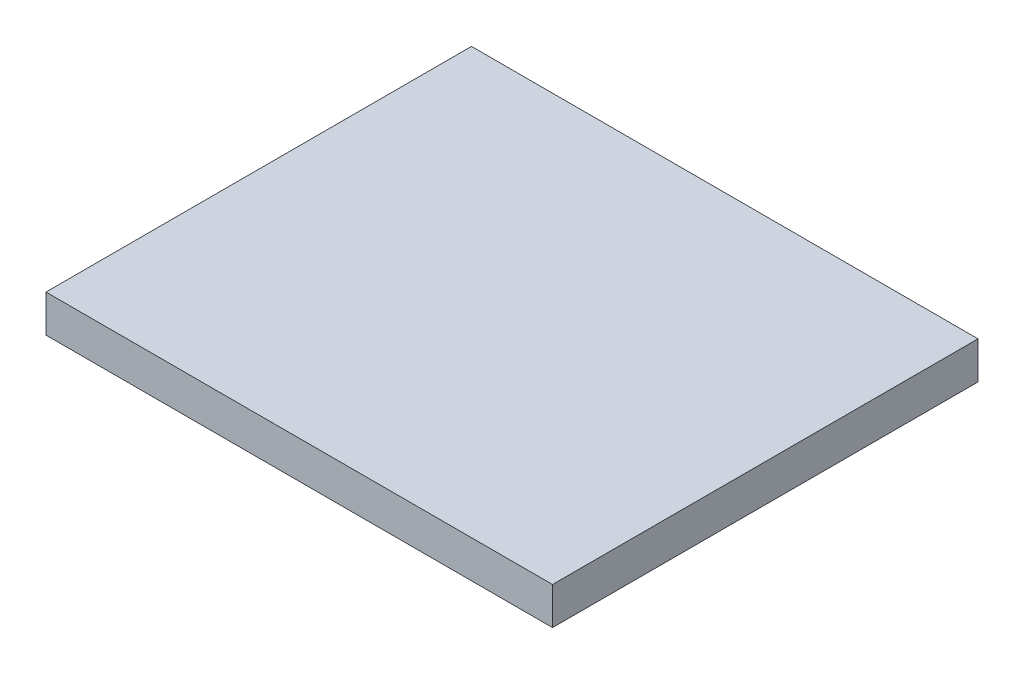
from build123d import *

# Parameters (mm, degrees)
SKETCH1_W               = 125
SKETCH1_H               = 105
TEST_BASE_POSTION_DEPTH = 9.215


with BuildPart() as part:
    # Sketch1 → Test_Base_Postion (new body)
    with BuildSketch(Plane(origin=(0, 0, 0), x_dir=(1, 0, 0), z_dir=(0, 1, 0))):
        Rectangle(SKETCH1_W, SKETCH1_H)
    extrude(amount=TEST_BASE_POSTION_DEPTH)


solid = part.part
